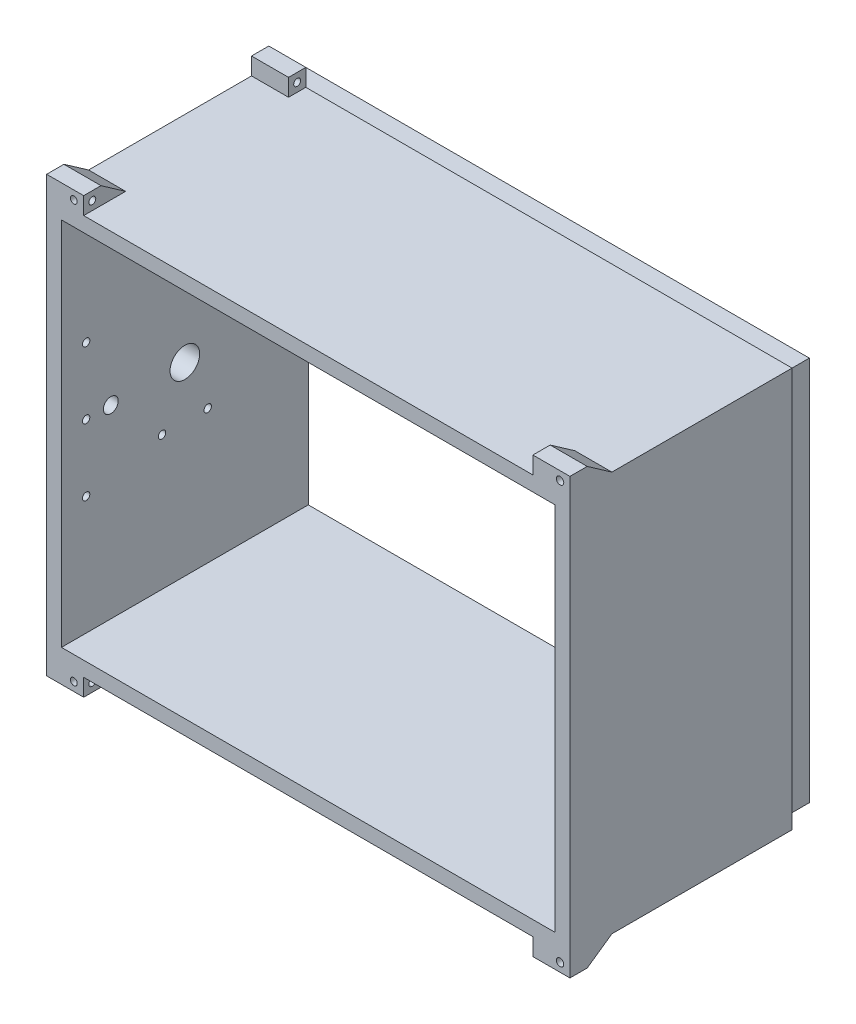
from build123d import *

# Parameters (mm, degrees)
SKETCH1_W           = 212
SKETCH1_H           = 162
SKETCH1_W_2         = 206
SKETCH1_H_2         = 156
SKETCH1_W_3         = 200
SKETCH1_H_3         = 150
BOSS_EXTRUDE1_DEPTH = 100
SKETCH1_4_W         = 212
SKETCH1_4_H         = 162
SKETCH1_4_W_2       = 206
SKETCH1_4_H_2       = 156
CUT_EXTRUDE2_DEPTH  = 10
SKETCH2_5_R         = 1.5
SKETCH2_5_R_2       = 6
CUT_EXTRUDE3_DEPTH  = 6
SKETCH2_W           = 10
SKETCH2_H           = 5.5
SKETCH2_R           = 1.5
BOSS_EXTRUDE4_DEPTH = 10.5
CHAMFER1_SIZE       = 2
BOSS_EXTRUDE5_START = 3
SKETCH2_12_W        = 22.5
SKETCH2_12_H        = 36.742349428
SKETCH2_12_R        = 6
SKETCH2_12_R_2      = 1.5
BOSS_EXTRUDE5_DEPTH = 3
SKETCH2_13_R        = 1.5
SKETCH2_13_R_2      = 3
CUT_EXTRUDE6_DEPTH  = 6
SKETCH2_14_R        = 2.5
SKETCH2_14_R_2      = 1.5
CUT_EXTRUDE7_DEPTH  = 3
SKETCH2_18_R        = 1.4
SKETCH2_18_W        = 7
SKETCH2_18_H        = 7
BOSS_EXTRUDE7_DEPTH = 15
BOSS_EXTRUDE8_DEPTH = 15
SKETCH13_R          = 1.4
SKETCH13_R_2        = 1.5
CUT_EXTRUDE14_DEPTH = 7


with BuildPart() as part:
    # Sketch1 → Boss-Extrude1 (new body)
    # profile 1 of 2: a face of its own
    with BuildSketch(Plane.XY):
        Rectangle(SKETCH1_W, SKETCH1_H)
        Rectangle(SKETCH1_W_2, SKETCH1_H_2, mode=Mode.SUBTRACT)
    # profile 2 of 2: a face of its own
    with BuildSketch(Plane.XY):
        Rectangle(SKETCH1_W_2, SKETCH1_H_2)
        Rectangle(SKETCH1_W_3, SKETCH1_H_3, mode=Mode.SUBTRACT)
    extrude(amount=BOSS_EXTRUDE1_DEPTH)

    # Sketch1<4> → Cut-Extrude2 (cut)
    with BuildSketch(Plane.XY):
        Rectangle(SKETCH1_4_W, SKETCH1_4_H)
        Rectangle(SKETCH1_4_W_2, SKETCH1_4_H_2, mode=Mode.SUBTRACT)
    extrude(amount=CUT_EXTRUDE2_DEPTH, mode=Mode.SUBTRACT)

    # Sketch2<5> → Cut-Extrude3 (cut)
    with BuildSketch(Plane.ZY.offset(106)):
        with Locations((40.75, -20.742349428)):
            Circle(SKETCH2_5_R)
        with Locations((59.25, -20.742349428)):
            Circle(SKETCH2_5_R)
        with Locations((50, 0)):
            Circle(SKETCH2_5_R_2)
    extrude(amount=-CUT_EXTRUDE3_DEPTH, mode=Mode.SUBTRACT)

    # Sketch2 → Boss-Extrude4 (add)
    with BuildSketch(Plane.ZY.offset(106)):
        with Locations((50, 13.75)):
            Rectangle(SKETCH2_W, SKETCH2_H)
        with Locations(Location((50, 13.5, 0), (0, 0, 180))):
            Circle(SKETCH2_R, mode=Mode.SUBTRACT)
    extrude(amount=BOSS_EXTRUDE4_DEPTH)

    # Chamfer1
    chamfer1_edges = [part.edges().sort_by_distance(p)[0] for p in [
        (-116.5, 13.75, 55),
        (-116.5, 13.75, 45),
    ]]
    chamfer(chamfer1_edges, length=CHAMFER1_SIZE)

    # Sketch2<12> → Boss-Extrude5 (add)
    with BuildSketch(Plane.ZY.offset(106).offset(BOSS_EXTRUDE5_START)):
        with Locations((50, -7.371174714)):
            Rectangle(SKETCH2_12_W, SKETCH2_12_H)
        with Locations((50, 0)):
            Circle(SKETCH2_12_R, mode=Mode.SUBTRACT)
        with Locations((40.75, -20.742349428)):
            Circle(SKETCH2_12_R_2, mode=Mode.SUBTRACT)
        with Locations((59.25, -20.742349428)):
            Circle(SKETCH2_12_R_2, mode=Mode.SUBTRACT)
    extrude(amount=-BOSS_EXTRUDE5_DEPTH)

    # Sketch2<13> → Cut-Extrude6 (cut)
    with BuildSketch(Plane.ZY.offset(106)):
        with Locations((90, 0)):
            Circle(SKETCH2_13_R)
        with Locations((90, 27)):
            Circle(SKETCH2_13_R)
        with Locations((90, -27)):
            Circle(SKETCH2_13_R)
        with Locations((80, 0)):
            Circle(SKETCH2_13_R_2)
    extrude(amount=-CUT_EXTRUDE6_DEPTH, mode=Mode.SUBTRACT)

    # Sketch2<14> → Cut-Extrude7 (cut)
    # profile 1 of 5: a face of its own
    with BuildSketch(Plane.ZY.offset(106)):
        with Locations((90, 27)):
            Circle(SKETCH2_14_R)
        with Locations((90, 27)):
            Circle(SKETCH2_14_R_2, mode=Mode.SUBTRACT)
    # profile 2 of 5: a face of its own
    with BuildSketch(Plane.ZY.offset(106)):
        with Locations((90, 0)):
            Circle(SKETCH2_14_R)
        with Locations((90, 0)):
            Circle(SKETCH2_14_R_2, mode=Mode.SUBTRACT)
    # profile 3 of 5: a face of its own
    with BuildSketch(Plane.ZY.offset(106)):
        with Locations((90, -27)):
            Circle(SKETCH2_14_R)
        with Locations((90, -27)):
            Circle(SKETCH2_14_R_2, mode=Mode.SUBTRACT)
    # profile 4 of 5: a face of its own
    with BuildSketch(Plane.ZY.offset(106)):
        with BuildLine():
            ThreePointArc((92.5, 0), (90, 2.5), (87.5, 0))
            Line((87.5, 0), (88.5, 0))
            ThreePointArc((88.5, 0), (90, 1.5), (91.5, 0))
            Line((91.5, 0), (92.5, 0))
        make_face()
    # profile 5 of 5: a face of its own
    with BuildSketch(Plane.ZY.offset(106)):
        with BuildLine():
            Line((88.5, 0), (87.5, 0))
            ThreePointArc((87.5, 0), (90, -2.5), (92.5, 0))
            Line((92.5, 0), (91.5, 0))
            ThreePointArc((91.5, 0), (90, -1.5), (88.5, 0))
        make_face()
    extrude(amount=-CUT_EXTRUDE7_DEPTH, mode=Mode.SUBTRACT)

    # Sketch2<18> → Boss-Extrude7 (add)
    # profile 1 of 4: a face of its own
    with BuildSketch(Plane.ZY.offset(106)):
        Polygon((93, 88), (83, 81), (93, 81), (100, 81), (100, 88), align=None)
        with Locations((96.5, 84.5)):
            Circle(SKETCH2_18_R, mode=Mode.SUBTRACT)
    # profile 2 of 4: a face of its own
    with BuildSketch(Plane.ZY.offset(106)):
        with Locations((13.5, 84.5)):
            Rectangle(SKETCH2_18_W, SKETCH2_18_H)
        with Locations((13.5, 84.5)):
            Circle(SKETCH2_18_R, mode=Mode.SUBTRACT)
    # profile 3 of 4: a face of its own
    with BuildSketch(Plane.ZY.offset(106)):
        with Locations((13.5, -84.5)):
            Rectangle(SKETCH2_18_W, SKETCH2_18_H)
        with Locations((13.5, -84.5)):
            Circle(SKETCH2_18_R, mode=Mode.SUBTRACT)
    # profile 4 of 4: a face of its own
    with BuildSketch(Plane.ZY.offset(106)):
        Polygon((93, -81), (83, -81), (93, -88), (100, -88), (100, -81), align=None)
        with Locations((96.5, -84.5)):
            Circle(SKETCH2_18_R, mode=Mode.SUBTRACT)
    extrude(amount=-BOSS_EXTRUDE7_DEPTH)

    # Sketch12 → Boss-Extrude8 (add)
    with BuildSketch(Plane(origin=(106, 0, 0), x_dir=(0, 0, -1), z_dir=(1, 0, 0))):
        Polygon((-100, -81), (-100, -88), (-93, -88), (-83, -81), align=None)
        Polygon((-100, 81), (-100, 88), (-93, 88), (-83, 81), align=None)
    extrude(amount=-BOSS_EXTRUDE8_DEPTH)

    # Sketch13 → Cut-Extrude14 (cut)
    with BuildSketch(Plane.XY.offset(100)):
        with Locations((-95, 84.5)):
            Circle(SKETCH13_R)
        with Locations((-95, -84.5)):
            Circle(SKETCH13_R)
        with Locations((102, 84.5)):
            Circle(SKETCH13_R_2)
        with Locations(Location((102, -84.5, 0), (0, 0, 180))):
            Circle(SKETCH13_R_2)
    extrude(amount=-CUT_EXTRUDE14_DEPTH, mode=Mode.SUBTRACT)


solid = part.part
